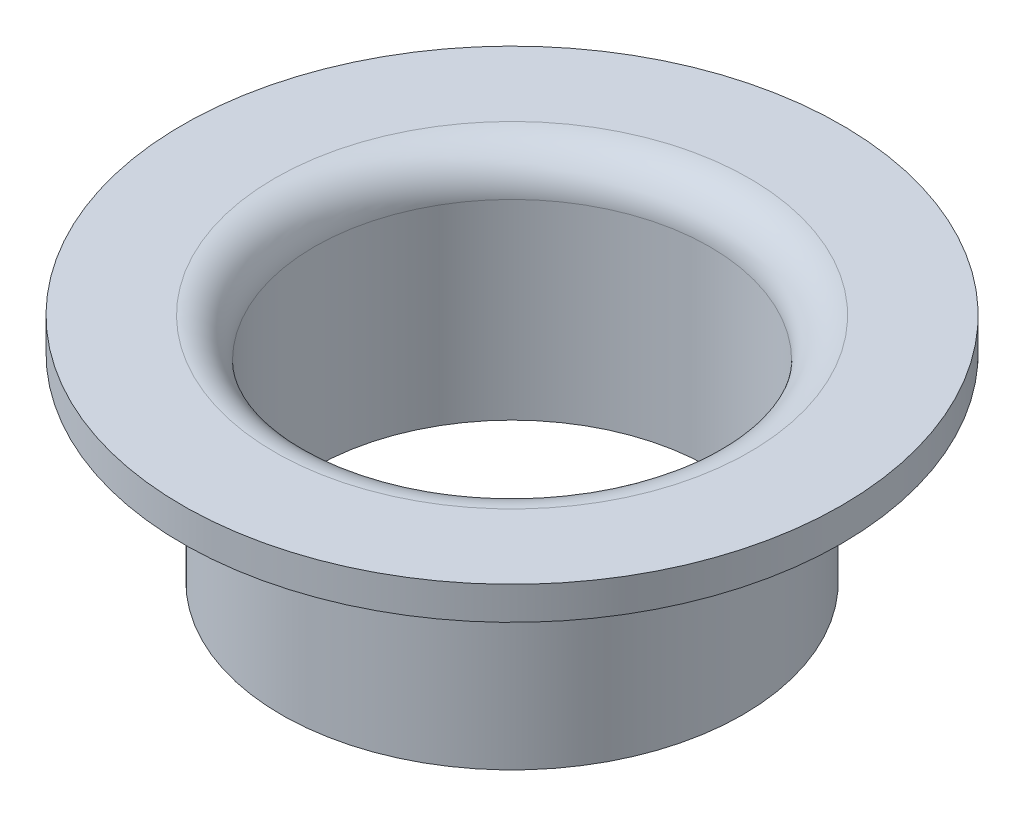
from build123d import *

# Parameters (mm, degrees)
CONG_0_2_R = 0.2
CONG_1_2_R = 1.2


with BuildPart() as part:
    # Esquisse1 → Base-Révolution (revolve)
    with BuildSketch(Plane(origin=(0, -0.000542726, 1021.101133201), x_dir=(1, 0, 0), z_dir=(0, -5.315106892389565e-07, 0.9999999999998588))):
        Polygon((1715.401443519, 541.998878787), (1711.40144353, 541.999169346), (1711.400935051, 534.999169365), (1712.400935049, 534.999096725), (1712.401370888, 540.999096709), (1715.40137088, 540.99887879), align=None)
    revolve(axis=Axis((1705.401443602, 541.999832964, 1021.10142128), (-7.263980373159368e-05, -0.9999999973615882, -5.315107006836232e-07)))

    # Congé0.2
    cong_0_2_edges = [part.edges().sort_by_distance(p)[0] for p in [
        (1698.401370924, 540.99957094, 1021.101420749),
    ]]
    fillet(cong_0_2_edges, radius=CONG_0_2_R)

    # Congé1.2
    cong_1_2_edges = [part.edges().sort_by_distance(p)[0] for p in [
        (1699.401443562, 541.999498298, 1021.10142128),
    ]]
    fillet(cong_1_2_edges, radius=CONG_1_2_R)


solid = part.part
